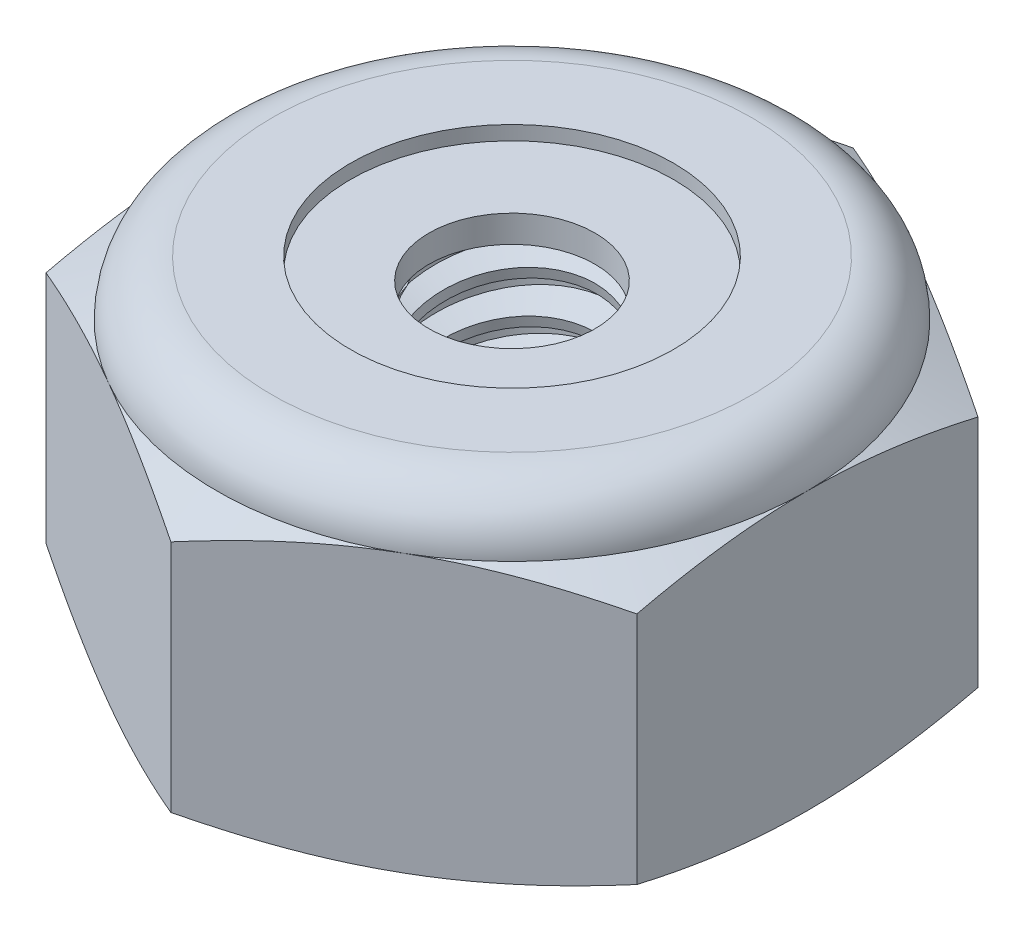
from build123d import *

# Parameters (mm, degrees)
EXTRUDE1_DEPTH      = 3.571875
SKETCH2_W           = 1.0922
SKETCH2_H           = 3.571875
LPATTERN1_COUNT     = 8
LPATTERN1_PITCH     = 0.453571429
LPATTERN1_COL_COUNT = 2
LPATTERN1_COL_PITCH = 0.453571429


with BuildPart() as part:
    # Sketch1 → Extrude1 (new body)
    with BuildSketch(Plane(origin=(0, 0, 0), x_dir=(1, 0, 0), z_dir=(0, 1, 0))):
        Polygon((0, 3.666174209), (-3.175, 1.833087105), (-3.175, -1.833087105), (0, -3.666174209), (3.175, -1.833087105), (3.175, 1.833087105), align=None)
    extrude(amount=EXTRUDE1_DEPTH)

    # Sketch4 → Cut-Revolve2 (revolve, cut)
    with BuildSketch(Plane(origin=(0, 0, 0), x_dir=(0, 0, -1), z_dir=(1, 0, 0)), mode=Mode.PRIVATE) as cut_revolve2_sk:
        Polygon((0, 3.571875), (1.0922, 3.571875), (0.892167741, 3.478598426), (0.892167741, 0.093276574), (1.0922, 0), (0, 0), align=None)
    revolve(cut_revolve2_sk.sketch.rotate(Axis((0, 3.571875, 0), (0, 1, 0)), 47.516980114), axis=Axis((0, 3.571875, 0), (0, 1, 0)), mode=Mode.SUBTRACT)


with BuildPart() as body_2:
    # Sketch2 → Revolve1 (revolve)
    with BuildSketch(Plane(origin=(0, 0, 0), x_dir=(0, 0, -1), z_dir=(1, 0, 0))):
        with Locations((0.5461, 1.7859375)):
            Rectangle(SKETCH2_W, SKETCH2_H)
    revolve(axis=Axis((0, -1.0922, 0), (0, 1, 0)))

    # Sketch3 → Cut-Revolve1 (revolve, cut)
    with BuildSketch(Plane(origin=(0, 0, 0), x_dir=(0, 0, -1), z_dir=(1, 0, 0)), mode=Mode.PRIVATE) as cut_revolve1_sk:
        Polygon((1.103726651, 3.516362647), (1.184413211, 3.127776177), (0.915221043, 3.216645195), (0.892167741, 3.327669901), align=None)
    cut_revolve1 = revolve(cut_revolve1_sk.sketch.rotate(Axis((0, 3.571875, 0.101196353), (0, -0.9791155152480937, -0.2033047166212824)), 180), axis=Axis((0, 3.571875, 0.101196353), (0, -0.9791155152480937, -0.2033047166212824)), mode=Mode.SUBTRACT)

    # LPattern1: Cut-Revolve1 ×8
    with Locations(*[(0, -i * LPATTERN1_PITCH, 0) for i in range(1, LPATTERN1_COUNT)]):
        add(cut_revolve1, mode=Mode.SUBTRACT)

    # LPattern1 col: Cut-Revolve1 ×2
    with Locations(*[(0, i * LPATTERN1_COL_PITCH, 0) for i in range(1, LPATTERN1_COL_COUNT)]):
        add(cut_revolve1, mode=Mode.SUBTRACT)


with BuildPart() as part_1:
    add(part.part)

    # Combine1: cut body 2
    add(body_2.part, mode=Mode.SUBTRACT)

    # Sketch5 → Cut-Revolve3 (revolve, cut)
    with BuildSketch(Plane(origin=(0, 0, 0), x_dir=(0, 0, -1), z_dir=(1, 0, 0)), mode=Mode.PRIVATE) as cut_revolve3_sk:
        with BuildLine():
            Line((0, 0), (3.175, 0))
            Line((3.175, 0), (3.666174209, 0.229038295))
            Line((3.666174209, 0.229038295), (3.666174209, 2.747524205))
            Line((3.666174209, 2.747524205), (3.175, 2.9765625))
            ThreePointArc((3.175, 2.9765625), (3.000637006, 3.397512006), (2.5796875, 3.571875))
            Line((2.5796875, 3.571875), (2.5796875, 4.841875))
            Line((2.5796875, 4.841875), (4.936174209, 4.841875))
            Line((4.936174209, 4.841875), (4.936174209, -1.27))
            Line((4.936174209, -1.27), (0, -1.27))
            Line((0, -1.27), (0, 0))
        make_face()
    revolve(cut_revolve3_sk.sketch.rotate(Axis((0, 0, 0), (0, 1, 0)), 47.516980114), axis=Axis((0, 0, 0), (0, 1, 0)), mode=Mode.SUBTRACT)

    # Sketch6 → Cut-Revolve4 (revolve, cut)
    with BuildSketch(Plane(origin=(0, 0, 0), x_dir=(0, 0, -1), z_dir=(1, 0, 0)), mode=Mode.PRIVATE) as cut_revolve4_sk:
        with BuildLine():
            Line((0, 2.9765625), (3.0226, 2.9765625))
            ThreePointArc((3.0226, 2.9765625), (2.892873932, 3.289748932), (2.5796875, 3.419475))
            Line((2.5796875, 3.419475), (1.73592762, 3.419475))
            Line((1.73592762, 3.419475), (1.73592762, 4.841875))
            Line((1.73592762, 4.841875), (0, 4.841875))
            Line((0, 4.841875), (0, 2.9765625))
        make_face()
    revolve(cut_revolve4_sk.sketch.rotate(Axis((0, 4.841875, 0), (0, 1, 0)), 47.516980114), axis=Axis((0, 4.841875, 0), (0, 1, 0)), mode=Mode.SUBTRACT)


with BuildPart() as body_2_2:
    # Sketch7 → Revolve2 (revolve)
    with BuildSketch(Plane(origin=(0, 0, 0), x_dir=(0, 0, -1), z_dir=(1, 0, 0))):
        with BuildLine():
            Line((0.892167741, 3.0527625), (2.938395763, 3.0527625))
            ThreePointArc((2.938395763, 3.0527625), (2.810484559, 3.261537543), (2.5796875, 3.343275))
            Line((2.5796875, 3.343275), (0.892167741, 3.343275))
            Line((0.892167741, 3.343275), (0.892167741, 3.0527625))
        make_face()
    revolve(axis=Axis((0, 3.0527625, 0), (0, 1, 0)))


solid = Compound([part_1.part, body_2_2.part])
